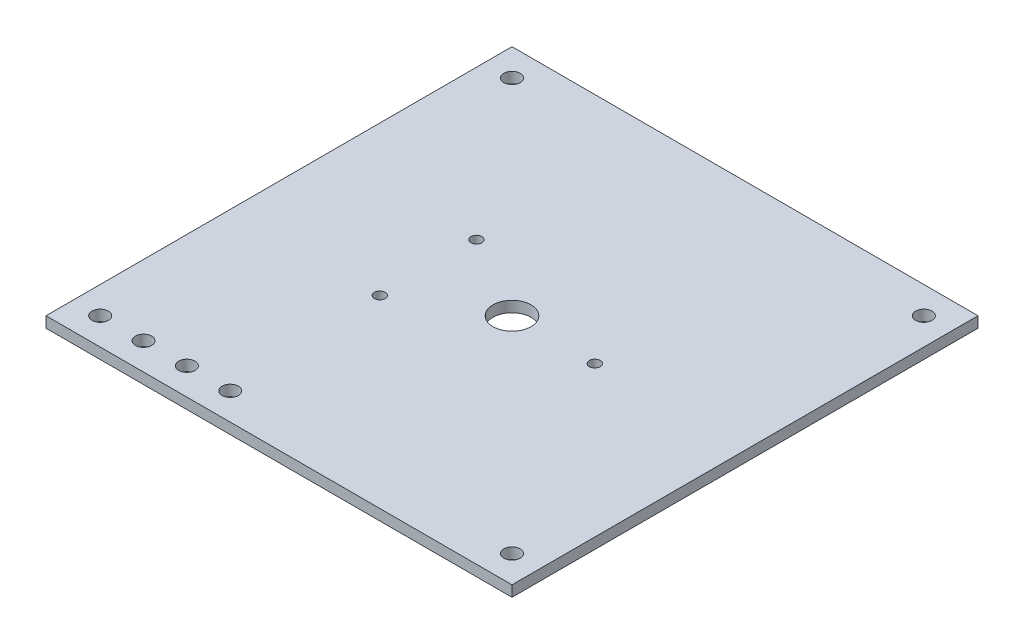
from build123d import *

# Parameters (mm, degrees)
SKETCH1_W           = 273.05
SKETCH1_H           = 273.05
SKETCH1_R           = 11.1125
BOSS_EXTRUDE1_DEPTH = 6.35
SKETCH2_R           = 4.7625
CUT_EXTRUDE1_DEPTH  = 194.179899964
SKETCH3_R           = 3.175
CUT_EXTRUDE4_DEPTH  = 194.179899964


with BuildPart() as part:
    # Sketch1 → Boss-Extrude1 (new body)
    with BuildSketch(Plane(origin=(0, 0, 0), x_dir=(1, 0, 0), z_dir=(0, 1, 0))):
        Rectangle(SKETCH1_W, SKETCH1_H)
        with Locations(Location((0, 0, 0), (0, 0, 270))):
            Circle(SKETCH1_R, mode=Mode.SUBTRACT)
    extrude(amount=BOSS_EXTRUDE1_DEPTH)

    # Sketch2 → Cut-Extrude1 (cut, through all)
    with BuildSketch(Plane(origin=(0, 6.35, 0), x_dir=(-1, 0, 0), z_dir=(0, 1, 0))):
        with Locations(Location((120.65, -120.65, 0), (0, 0, 90))):
            Circle(SKETCH2_R)
        with Locations(Location((120.65, 120.65, 0), (0, 0, 270))):
            Circle(SKETCH2_R)
        with Locations(Location((-120.65, -120.65, 0), (0, 0, 270))):
            Circle(SKETCH2_R)
        with Locations(Location((-120.65, 120.65, 0), (0, 0, 90))):
            Circle(SKETCH2_R)
        with Locations(Location((95.25, 120.65, 0), (0, 0, 90))):
            Circle(SKETCH2_R)
        with Locations(Location((69.85, 120.65, 0), (0, 0, 90))):
            Circle(SKETCH2_R)
        with Locations(Location((44.45, 120.65, 0), (0, 0, 90))):
            Circle(SKETCH2_R)
    extrude(amount=-CUT_EXTRUDE1_DEPTH, mode=Mode.SUBTRACT)

    # Sketch3 → Cut-Extrude4 (cut, through all)
    with BuildSketch(Plane(origin=(0, 6.35, 0), x_dir=(-1, 0, 0), z_dir=(0, 1, 0))):
        with Locations(Location((49.022, -28.194, 0), (0, 0, 90))):
            Circle(SKETCH3_R)
        with Locations(Location((49.022, 28.446, 0), (0, 0, 90))):
            Circle(SKETCH3_R)
        with Locations(Location((-48.514, 0, 0), (0, 0, 90))):
            Circle(SKETCH3_R)
    extrude(amount=-CUT_EXTRUDE4_DEPTH, mode=Mode.SUBTRACT)


solid = part.part
